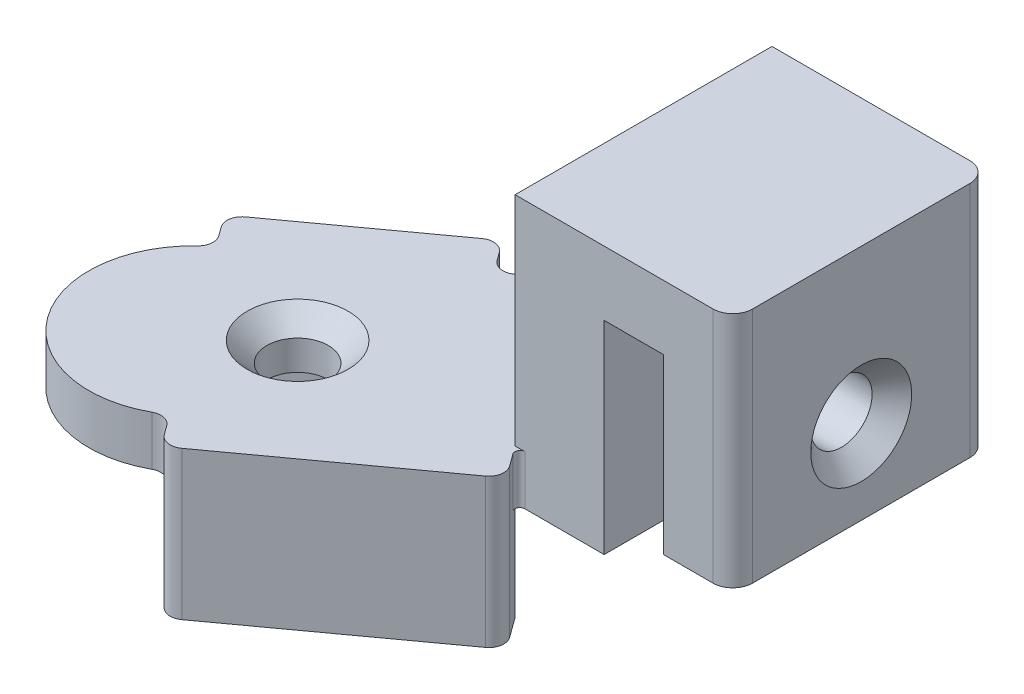
from build123d import *

# Parameters (mm, degrees)
SKETCH_1_R             = 1.55
EXTRUDE_386_DEPTH      = 2.5
EXTRUDE_START          = 2.5
EXTRUDE_629_DEPTH      = 7.5
SKETCH_3_W             = 4.5
SKETCH_3_H             = 12.978713764
EXTRUDE_1_DEPTH        = 13.5
EXTRUDE_START_2        = -0.866441
EXTRUDE_2_DEPTH        = 12.978713764
SKETCH_5_R             = 1.55
CUT_EXTRUDE_1293_DEPTH = 36.225185951
CUT_EXTRUDE_START      = -9
SKETCH_5_3_R           = 1.55
CUT_EXTRUDE_1335_DEPTH = 2
CHAMFER_1_SIZE         = 1
FILLET_5_R             = 0.75
FILLET_6_R             = 0.25
FILLET_8_R             = 1


with BuildPart() as part:
    # 草图1 → Extrude 386 (new body)
    with BuildSketch(Plane(origin=(0, 0, 0), x_dir=(1, 0, 0), z_dir=(0, 1, 0))):
        with BuildLine():
            Line((10.1243866, 13.845154317), (-6.15423406, 2.01804411))
            ThreePointArc((-6.15423406, 2.01804411), (-7.315700706, -5.315167685), (0.017511089, -6.476634331))
            Line((0.017511089, -6.476634331), (10.1243866, 0.866440553))
            Line((10.1243866, 0.866440553), (10.1243866, 13.845154317))
        make_face()
        with Locations(Location((0, 0, 0), (0, 0, 270))):
            Circle(SKETCH_1_R, mode=Mode.SUBTRACT)
    extrude(amount=EXTRUDE_386_DEPTH)

    # 草图2 → Extrude 629 (add)
    with BuildSketch(Plane(origin=(0, 0, 0), x_dir=(1, 0, 0), z_dir=(0, 1, 0)).offset(EXTRUDE_START)):
        Polygon((0.017511089, -6.476634331), (1.193081594, -8.09466832), (11.299957105, -0.751593436), (10.1243866, 0.866440553), align=None)
        Polygon((-7.329804565, 3.636078099), (0.809505765, 9.549633202), (1.98507627, 7.931599213), (-6.15423406, 2.01804411), align=None)
    extrude(amount=-EXTRUDE_629_DEPTH)

    # 草图3 → 限位-1 (add)
    with BuildSketch(Plane(origin=(0, 0, 0), x_dir=(1, 0, 0), z_dir=(0, 1, 0))):
        with Locations((12.3743866, 7.355797435)):
            Rectangle(SKETCH_3_W, SKETCH_3_H)
    extrude(amount=EXTRUDE_1_DEPTH)

    # 草图4 → 限位-2 (add)
    with BuildSketch(Plane.XY.offset(EXTRUDE_START_2)):
        Polygon((14.6243866, 13.5), (21.1243866, 13.5), (21.1243866, 1.5), (17.6243866, 1.5), (17.6243866, 10.25), (14.6243866, 10.25), align=None)
    extrude(amount=-EXTRUDE_2_DEPTH)

    # 草图5 → Cut-Extrude 1293 (cut, through all)
    with BuildSketch(Plane(origin=(21.1243866, 0, 0), x_dir=(0, 0, -1), z_dir=(1, 0, 0))):
        with Locations(Location((7.355797435, 5.75, 0), (0, 0, 90))):
            Circle(SKETCH_5_R)
    extrude(amount=-CUT_EXTRUDE_1293_DEPTH, mode=Mode.SUBTRACT)

    # 草图5<3> → Cut-Extrude 1335 (cut)
    with BuildSketch(Plane(origin=(21.1243866, 0, 0), x_dir=(0, 0, -1), z_dir=(1, 0, 0)).offset(CUT_EXTRUDE_START)):
        Polygon((8.957944432, 2.975), (10.560091429, 5.75), (8.957944432, 8.525), (5.753650438, 8.525), (4.151503441, 5.75), (5.753650438, 2.975), align=None)
        with Locations(Location((7.355797435, 5.75, 0), (0, 0, 90))):
            Circle(SKETCH_5_3_R, mode=Mode.SUBTRACT)
    extrude(amount=-CUT_EXTRUDE_1335_DEPTH, mode=Mode.SUBTRACT)

    # 倒角1
    chamfer_1_edges = [part.edges().sort_by_distance(p)[0] for p in [
        (0, 2.5, -1.55),
        (21.1243866, 4.2, -7.355797435),
    ]]
    chamfer(chamfer_1_edges, length=CHAMFER_1_SIZE)

    # 圆角5
    fillet_5_edges = [part.edges().sort_by_distance(p)[0] for p in [
        (11.299957105, -1.25, 0.751593436),
        (1.193081594, -1.25, 8.09466832),
        (1.98507627, 1.25, -7.931599213),
        (-7.329804565, -1.25, -3.636078099),
        (0.809505765, -1.25, -9.549633202),
        (-6.15423406, 1.25, -2.01804411),
        (0.017511089, 1.25, 6.476634331),
    ]]
    fillet(fillet_5_edges, radius=FILLET_5_R)

    # 圆角6
    fillet_6_edges = [part.edges().sort_by_distance(p)[0] for p in [
        (10.1243866, 1.25, -0.866440553),
    ]]
    fillet(fillet_6_edges, radius=FILLET_6_R)

    # 圆角8
    fillet_8_edges = [part.edges().sort_by_distance(p)[0] for p in [
        (21.1243866, 7.5, -13.845154764),
        (21.1243866, 7.5, -0.866441),
    ]]
    fillet(fillet_8_edges, radius=FILLET_8_R)


solid = part.part
